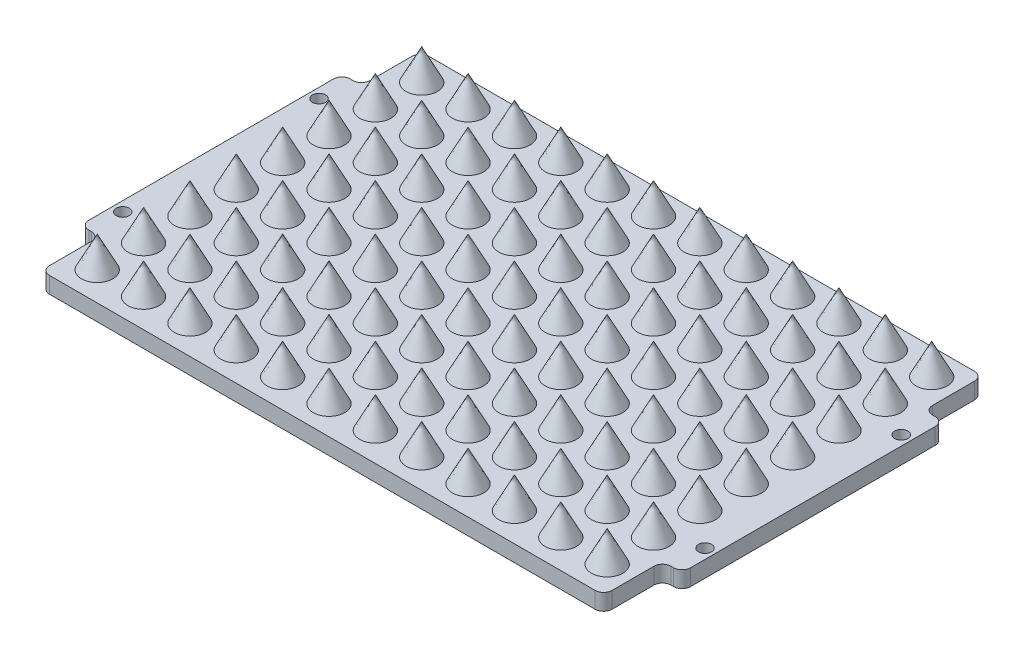
from build123d import *

# Parameters (mm, degrees)
SKETCH1_W            = 109.22
SKETCH1_H            = 73.66
BOSS_EXTRUDE1_DEPTH  = 3.175
LPATTERN1_COUNT      = 12
LPATTERN1_PITCH      = 9
LPATTERN1_COUNT_DIR2 = 8
LPATTERN1_PITCH_DIR2 = 9
SKETCH3_W            = 3.81
SKETCH3_H            = 50.8
SKETCH3_R            = 1.27
BOSS_EXTRUDE2_DEPTH  = 3.175
FILLET1_R            = 1.651


with BuildPart() as part:
    # Sketch1 → Boss-Extrude1 (new body)
    with BuildSketch(Plane(origin=(0, 0, 0), x_dir=(1, 0, 0), z_dir=(0, 1, 0))):
        Rectangle(SKETCH1_W, SKETCH1_H)
    extrude(amount=-BOSS_EXTRUDE1_DEPTH)

    # Sketch2 → Revolve3 (revolve)
    with BuildSketch(Plane.XY.offset(-31.75), mode=Mode.PRIVATE) as revolve3_sk:
        Polygon((-52.324, 0), (-49.276, 6), (-49.276, 0), align=None)
    revolve3 = revolve(revolve3_sk.sketch.rotate(Axis((-49.276, 6, -31.75), (0, -1, 0)), 90), axis=Axis((-49.276, 6, -31.75), (0, -1, 0)))

    # LPattern1: Revolve3 12 × 8
    with Locations(*[(i * LPATTERN1_PITCH, 0, j * LPATTERN1_PITCH_DIR2) for i in range(LPATTERN1_COUNT) for j in range(LPATTERN1_COUNT_DIR2) if (i, j) != (0, 0)]):
        add(revolve3)

    # Sketch3 → Boss-Extrude2 (add)
    # profile 1 of 2: a face of its own
    with BuildSketch(Plane(origin=(0, 0, 0), x_dir=(1, 0, 0), z_dir=(0, 1, 0))):
        with Locations((-56.515, 0)):
            Rectangle(SKETCH3_W, SKETCH3_H)
        with Locations(Location((-56.515, 19.05, 0), (0, 0, 270))):
            Circle(SKETCH3_R, mode=Mode.SUBTRACT)
        with Locations(Location((-56.515, -19.05, 0), (0, 0, 270))):
            Circle(SKETCH3_R, mode=Mode.SUBTRACT)
    # profile 2 of 2: a face of its own
    with BuildSketch(Plane(origin=(0, 0, 0), x_dir=(1, 0, 0), z_dir=(0, 1, 0))):
        with Locations((56.515, 0)):
            Rectangle(SKETCH3_W, SKETCH3_H)
        with Locations(Location((56.515, -19.05, 0), (0, 0, 90))):
            Circle(SKETCH3_R, mode=Mode.SUBTRACT)
        with Locations(Location((56.515, 19.05, 0), (0, 0, 90))):
            Circle(SKETCH3_R, mode=Mode.SUBTRACT)
    extrude(amount=-BOSS_EXTRUDE2_DEPTH)

    # Fillet1
    fillet1_edges = [part.edges().sort_by_distance(p)[0] for p in [
        (-54.61, -1.5875, -25.4),
        (-54.61, -1.5875, 25.4),
        (-58.42, -1.5875, 25.4),
        (-58.42, -1.5875, -25.4),
        (54.61, -1.5875, -25.4),
        (58.42, -1.5875, -25.4),
        (58.42, -1.5875, 25.4),
        (54.61, -1.5875, 25.4),
        (54.61, -1.5875, 36.83),
        (-54.61, -1.5875, 36.83),
        (-54.61, -1.5875, -36.83),
        (54.61, -1.5875, -36.83),
    ]]
    fillet(fillet1_edges, radius=FILLET1_R)


solid = part.part
